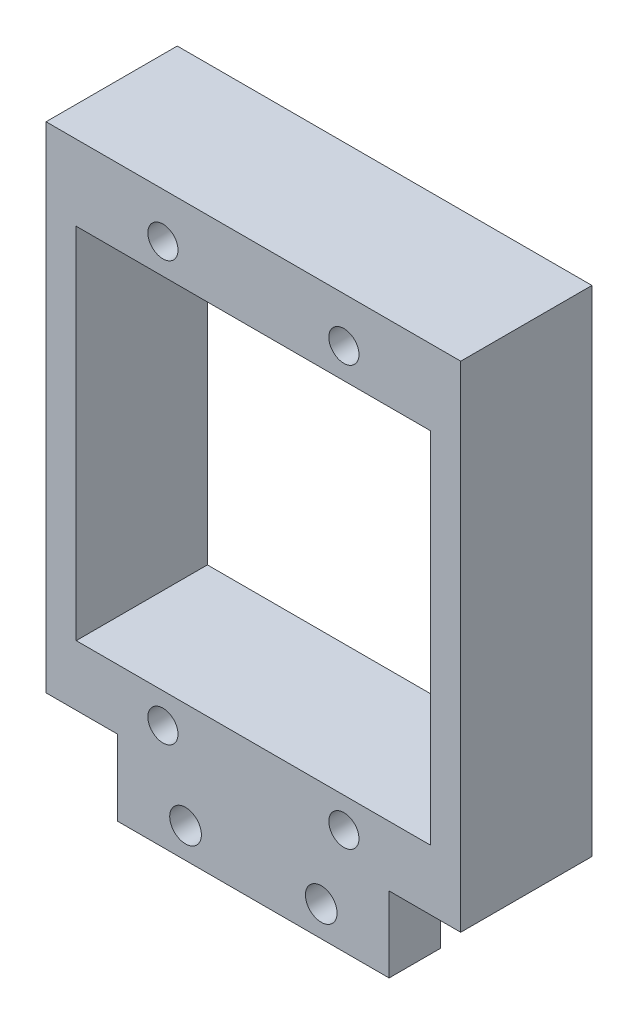
from build123d import *

# Parameters (mm, degrees)
SKETCH1_W           = 18
SKETCH1_H           = 5
BOSS_EXTRUDE1_DEPTH = 3.4
SKETCH2_W           = 27.5
SKETCH2_H           = 4
BOSS_EXTRUDE2_DEPTH = 8.7
SKETCH3_W           = 2
SKETCH3_H           = 8.7
BOSS_EXTRUDE3_DEPTH = 23.8
SKETCH4_W           = 27.5
SKETCH4_H           = 8.7
BOSS_EXTRUDE4_DEPTH = 5
SKETCH5_R           = 1.05
SKETCH5_R_2         = 1
CUT_EXTRUDE1_DEPTH  = 39.869557497


with BuildPart() as part:
    # Sketch1 → Boss-Extrude1 (new body)
    with BuildSketch(Plane.XY):
        Rectangle(SKETCH1_W, SKETCH1_H)
    extrude(amount=BOSS_EXTRUDE1_DEPTH)

    # Sketch2 → Boss-Extrude2 (add)
    with BuildSketch(Plane.XY.offset(3.4)):
        with Locations((0, 4.5)):
            Rectangle(SKETCH2_W, SKETCH2_H)
    extrude(amount=-BOSS_EXTRUDE2_DEPTH)

    # Sketch3 → Boss-Extrude3 (add)
    with BuildSketch(Plane(origin=(0, 6.5, 0), x_dir=(1, 0, 0), z_dir=(0, 1, 0))):
        with Locations((-12.75, 0.95)):
            Rectangle(SKETCH3_W, SKETCH3_H)
        with Locations((12.75, 0.95)):
            Rectangle(SKETCH3_W, SKETCH3_H)
    extrude(amount=BOSS_EXTRUDE3_DEPTH)

    # Sketch4 → Boss-Extrude4 (add)
    with BuildSketch(Plane(origin=(0, 30.3, 0), x_dir=(1, 0, 0), z_dir=(0, 1, 0))):
        with Locations((0, 0.95)):
            Rectangle(SKETCH4_W, SKETCH4_H)
    extrude(amount=BOSS_EXTRUDE4_DEPTH)

    # Sketch5 → Cut-Extrude1 (cut, through all)
    with BuildSketch(Plane.XY.offset(3.4)):
        with Locations((-4.5, -0.5)):
            Circle(SKETCH5_R)
        with Locations((4.5, -0.5)):
            Circle(SKETCH5_R)
        with Locations((-6, 4.5)):
            Circle(SKETCH5_R_2)
        with Locations((6, 4.5)):
            Circle(SKETCH5_R_2)
        with Locations(Location((6, 32.3, 0), (0, 0, 180))):
            Circle(SKETCH5_R_2)
        with Locations(Location((-6, 32.3, 0), (0, 0, 180))):
            Circle(SKETCH5_R_2)
    extrude(amount=-CUT_EXTRUDE1_DEPTH, mode=Mode.SUBTRACT)


solid = part.part
